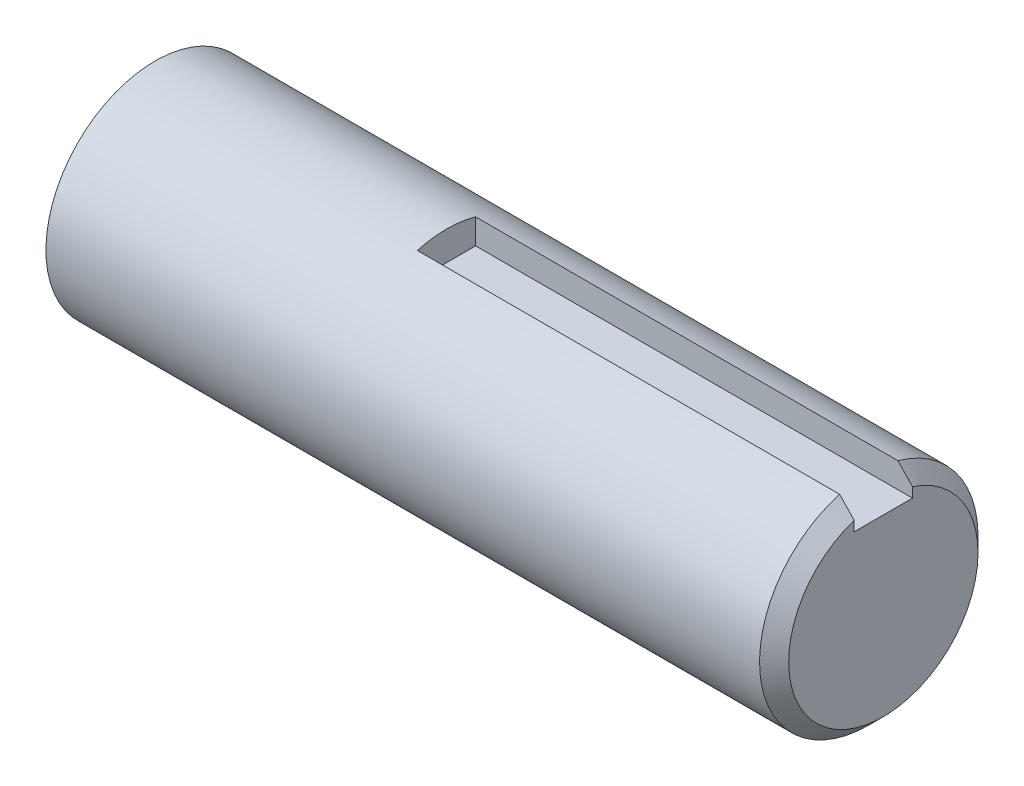
from build123d import *

# Parameters (mm, degrees)
SKETCH1_R           = 15
BOSS_EXTRUDE1_DEPTH = 50
CUT_EXTRUDE1_DEPTH  = 60
CHAMFER1_SIZE       = 2


with BuildPart() as part:
    # Sketch1 → Boss-Extrude1 (new, symmetric)
    with BuildSketch(Plane(origin=(0, 0, 0), x_dir=(0, 0, -1), z_dir=(1, 0, 0))):
        Circle(SKETCH1_R)
    extrude(amount=BOSS_EXTRUDE1_DEPTH, both=True)

    # Sketch2 → Cut-Extrude1 (cut)
    with BuildSketch(Plane(origin=(50, 0, 0), x_dir=(0, 0, -1), z_dir=(1, 0, 0))):
        Polygon((-4, 94.562608629), (-4, 14.456832295), (-4, 11), (4, 11), (4, 14.456832295), (4, 94.562608629), (4, 254.774161296), (-4, 254.774161296), align=None)
    extrude(amount=-CUT_EXTRUDE1_DEPTH, mode=Mode.SUBTRACT)

    # Chamfer1
    chamfer1_edges = [part.edges().sort_by_distance(p)[0] for p in [
        (50, -11.937336386, 9.082951062),
    ]]
    chamfer(chamfer1_edges, length=CHAMFER1_SIZE)


solid = part.part
